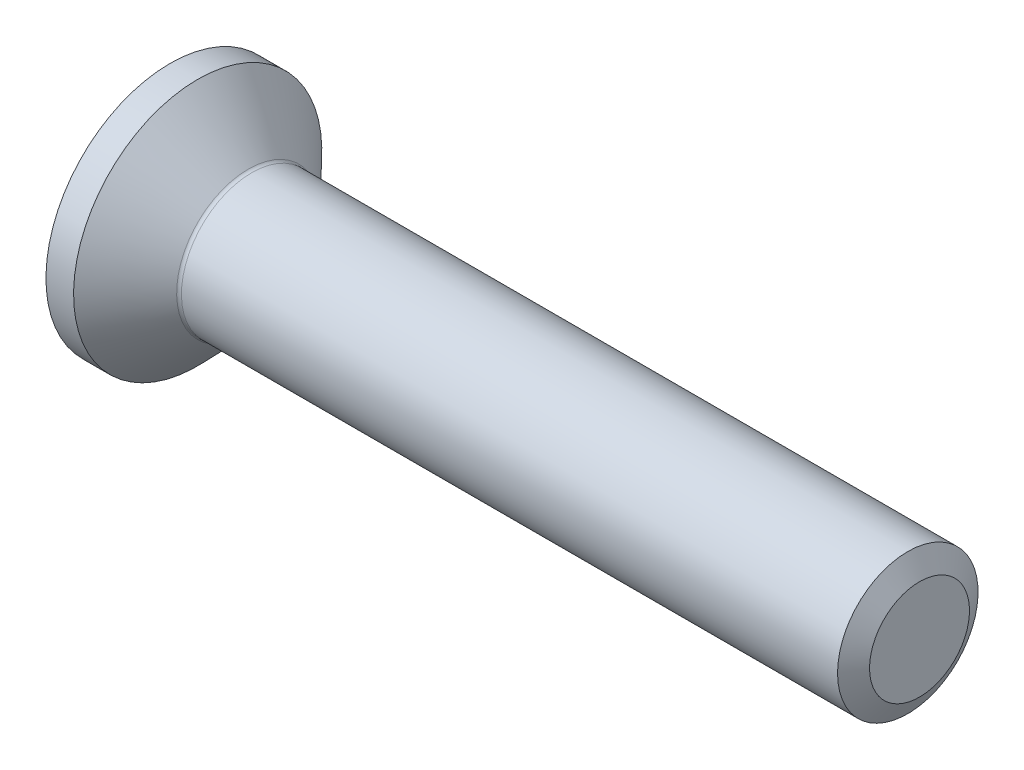
from build123d import *

# Parameters (mm, degrees)
CUT_EXTRUDE_1_DEPTH = 1.86


with BuildPart() as part:
    # 草图1 → 旋转1 (revolve)
    with BuildSketch(Plane.XY):
        with BuildLine():
            Line((0, 1.5), (-14.257552518, 1.5))
            ThreePointArc((-14.257552518, 1.5), (-14.296625631, 1.507949515), (-14.329486498, 1.530534163))
            Line((-14.329486498, 1.530534163), (-15.410542091, 2.65))
            Line((-15.410542091, 2.65), (-16, 2.65))
            Line((-16, 2.65), (-16, 0))
            Line((-16, 0), (0, 0))
            Line((0, 0), (0, 1.5))
        make_face()
    revolve(axis=Axis((0, 0, 0), (-1, 0, 0)))

    # 草图2 → 切除-拉伸1 (cut)
    with BuildSketch(Plane.ZY.offset(16)):
        Polygon((0, 1.154700538), (-1, 0.577350269), (-1, -0.577350269), (0, -1.154700538), (1, -0.577350269), (1, 0.577350269), align=None)
    extrude(amount=-CUT_EXTRUDE_1_DEPTH, mode=Mode.SUBTRACT)

    # 草图6 → 旋转2 (revolve)
    with BuildSketch(Plane.XY):
        Polygon((-14.9, 1.154700538), (-14.233333333, 0), (-13.84, 0), (-13.84, 1.154700538), align=None)
    revolve(axis=Axis((-16, 0, 0), (1, 0, 0)))

    # 草图7 → 切除-旋转2 (revolve, cut)
    with BuildSketch(Plane.XY):
        Polygon((-16, 1.154700538), (-16, 0), (-15.7, 0), align=None)
    revolve(axis=Axis((-16, 0, 0), (1, 0, 0)), mode=Mode.SUBTRACT)

    # 草图4 → 切除-旋转1 (revolve, cut)
    with BuildSketch(Plane.XY):
        Polygon((-0.25, 1.5), (0, 1.066987298), (0.25, 1.5), align=None)
    revolve(axis=Axis((-0.25, 0, 0), (1, 0, 0)), mode=Mode.SUBTRACT)


solid = part.part
